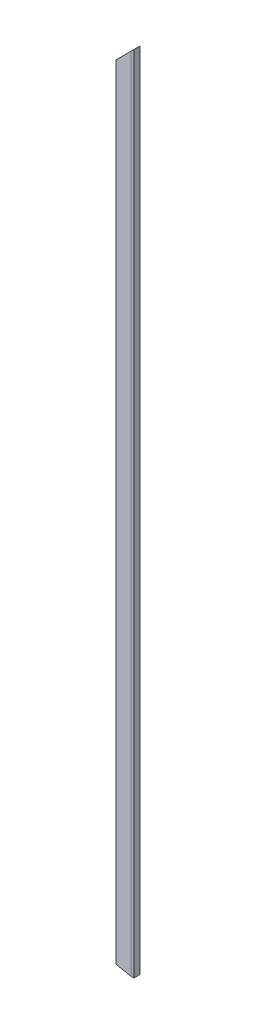
from build123d import *

# Parameters (mm, degrees)
BOSS_EXTRUDE1_DEPTH = 2092.325
CUT_EXTRUDE1_DEPTH  = 2094.081274551


with BuildPart() as part:
    # Sketch1 → Boss-Extrude1 (new body)
    with BuildSketch(Plane(origin=(0, 0, 0), x_dir=(1, 0, 0), z_dir=(0, 1, 0))):
        Polygon((0, 0), (53.975, 0), (53.975, -15.875), (46.355, -15.875), (0, -8.255), align=None)
    extrude(amount=BOSS_EXTRUDE1_DEPTH)

    # Sketch2 → Cut-Extrude1 (cut, through all)
    with BuildSketch(Plane.XY.offset(15.875)):
        Polygon((53.975, 2092.325), (0, 2038.35), (0, 2092.325), align=None)
    extrude(amount=-CUT_EXTRUDE1_DEPTH, mode=Mode.SUBTRACT)


solid = part.part
